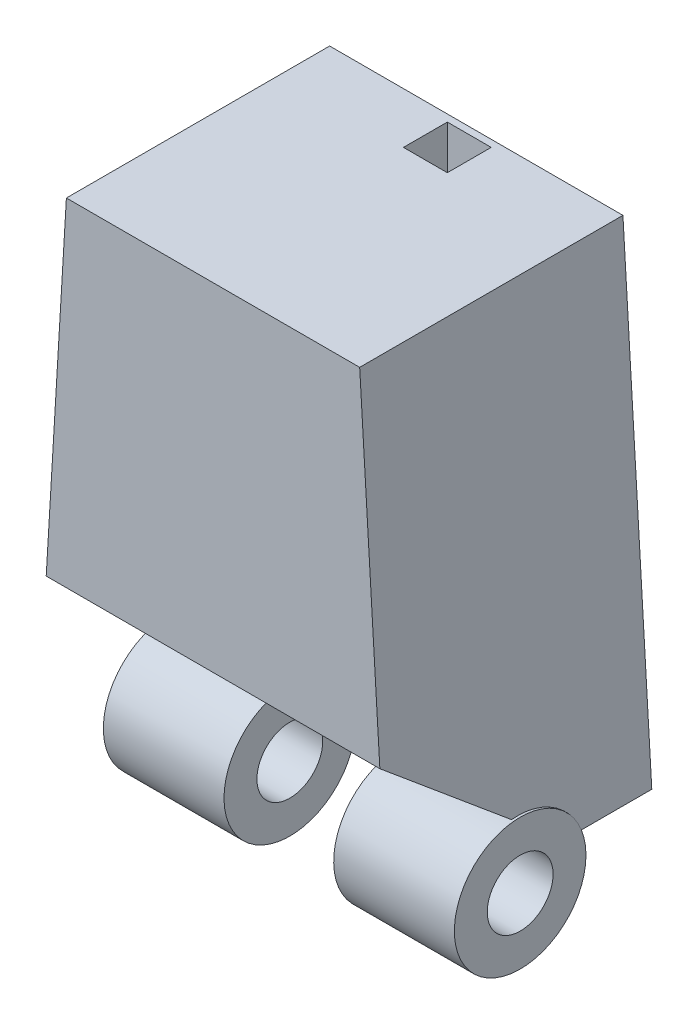
from build123d import *

# Parameters (mm, degrees)
BOSS_EXTRUDE1_DEPTH     = 12
CUT_EXTRUDE1_DEPTH      = 33.105995151
CUT_EXTRUDE1_DEPTH_BACK = 33.105995151
SKETCH6_R               = 3
SKETCH6_R_2             = 1.5
BOSS_EXTRUDE2_DEPTH     = 8
SKETCH6_3_R             = 3
SKETCH6_3_R_2           = 1.5
CUT_EXTRUDE2_DEPTH      = 2.5
CUT_EXTRUDE3_DEPTH      = 5
SKETCH8_R               = 1.5
BOSS_EXTRUDE3_DEPTH     = 5.5
CUT_EXTRUDE4_DEPTH      = 33.105995151
CUT_EXTRUDE4_DEPTH_BACK = 33.105995151
SKETCH9_W               = 12
SKETCH9_H               = 6.684402114
CUT_EXTRUDE5_DEPTH      = 1


with BuildPart() as part:
    # Sketch1 → Boss-Extrude1 (new body)
    with BuildSketch(Plane.XY):
        with BuildLine():
            Line((-56.5742778, 0), (-40.5742778, 0))
            Line((-40.5742778, 0), (-41.889875686, 22))
            ThreePointArc((-41.889875686, 22), (-48.5742778, 28.684402114), (-55.258679913, 22))
            Line((-55.258679913, 22), (-56.5742778, 0))
        make_face()
    extrude(amount=BOSS_EXTRUDE1_DEPTH)

    # Sketch3 → Cut-Extrude1 (cut, two sides: drawn at the far end of the back side and taken through both)
    with BuildSketch(Plane(origin=(-48.5742778, 0, 0), x_dir=(0, 0, -1), z_dir=(1, 0, 0)).offset(-CUT_EXTRUDE1_DEPTH_BACK)):
        Polygon((-12, 0), (-4, 0), (-12, 6.613954944), align=None)
    extrude(amount=CUT_EXTRUDE1_DEPTH + CUT_EXTRUDE1_DEPTH_BACK, mode=Mode.SUBTRACT)

    # Sketch6 → Boss-Extrude2 (add, symmetric)
    with BuildSketch(Plane(origin=(-48.5742778, 0, 0), x_dir=(0, 0, -1), z_dir=(1, 0, 0))):
        with Locations((-6, -1.1)):
            Circle(SKETCH6_R)
        with Locations((-6, -1.1)):
            Circle(SKETCH6_R_2, mode=Mode.SUBTRACT)
    extrude(amount=BOSS_EXTRUDE2_DEPTH, both=True)

    # Sketch6<3> → Cut-Extrude2 (cut, symmetric)
    with BuildSketch(Plane(origin=(-48.5742778, 0, 0), x_dir=(0, 0, -1), z_dir=(1, 0, 0))):
        with Locations((-6, -1.1)):
            Circle(SKETCH6_3_R)
        with Locations((-6, -1.1)):
            Circle(SKETCH6_3_R_2, mode=Mode.SUBTRACT)
    extrude(amount=CUT_EXTRUDE2_DEPTH, both=True, mode=Mode.SUBTRACT)

    # Sketch7 → Cut-Extrude3 (cut, symmetric)
    with BuildSketch(Plane(origin=(-48.5742778, 0, 0), x_dir=(0, 0, -1), z_dir=(1, 0, 0))):
        Polygon((-7.161655697, 2.613881041), (-11.015220244, 5.799793827), (-7.829307458, 9.653358374), (-3.975742911, 6.467445588), align=None)
    extrude(amount=CUT_EXTRUDE3_DEPTH, both=True, mode=Mode.SUBTRACT)

    # Sketch8 → Boss-Extrude3 (add, symmetric)
    with BuildSketch(Plane(origin=(-48.5742778, 0, 0), x_dir=(0, 0, -1), z_dir=(1, 0, 0))):
        with Locations((-7.548090256, 6.177113636)):
            Circle(SKETCH8_R)
    extrude(amount=BOSS_EXTRUDE3_DEPTH, both=True)

    # Sketch9 → Cut-Extrude4 (cut, two sides: drawn at the far end of the back side and taken through both)
    with BuildSketch(Plane(origin=(-48.5742778, 0, 0), x_dir=(0, 0, -1), z_dir=(1, 0, 0)).offset(-CUT_EXTRUDE4_DEPTH_BACK)):
        with Locations((-6, 25.342201057)):
            Rectangle(SKETCH9_W, SKETCH9_H)
    extrude(amount=CUT_EXTRUDE4_DEPTH + CUT_EXTRUDE4_DEPTH_BACK, mode=Mode.SUBTRACT)

    # Sketch11 → Cut-Extrude5 (cut, symmetric)
    with BuildSketch(Plane(origin=(-48.5742778, 0, 0), x_dir=(0, 0, -1), z_dir=(1, 0, 0))):
        Polygon((-0.32, 22), (-2.32, 22), (-2.32, 20.543562606), (-2.32, -1.562377034), (-0.32, -1.562377034), (-0.32, 20.543562606), align=None)
    extrude(amount=CUT_EXTRUDE5_DEPTH, both=True, mode=Mode.SUBTRACT)


solid = part.part
